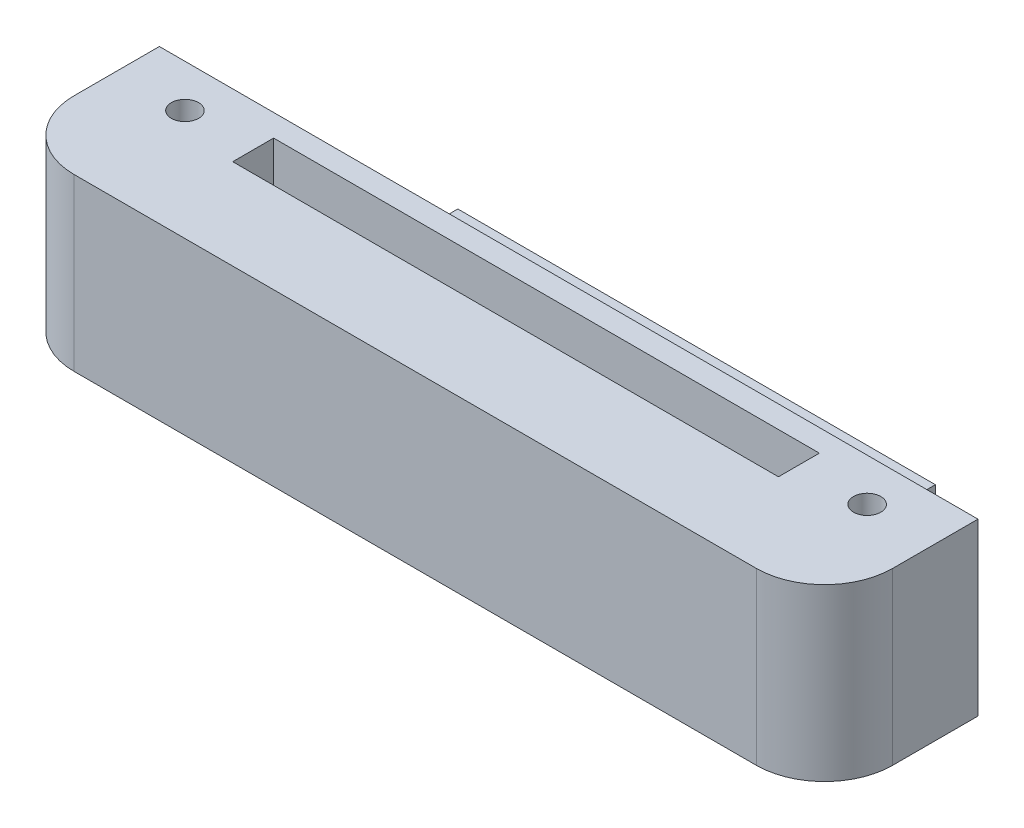
from build123d import *

# Parameters (mm, degrees)
SKETCH1_W             = 120
SKETCH1_H             = 31.25
BOSS_EXTRUDE1_DEPTH   = 25
SKETCH2_W             = 18.75
SKETCH2_H             = 17.5
CUT_EXTRUDE1_DEPTH    = 124.568364175
F_4_0MM_DOWEL_HOLE1_D = 4
SKETCH5_W             = 120
SKETCH5_H             = 25
BOSS_EXTRUDE2_DEPTH   = 10
SKETCH6_W             = 80
SKETCH6_H             = 6
CUT_EXTRUDE2_DEPTH    = 17.5
FILLET1_R             = 10
SKETCH7_W             = 25
SKETCH7_H             = 18.75
CUT_EXTRUDE3_DEPTH    = 25


with BuildPart() as part:
    # Sketch1 → Boss-Extrude1 (new body)
    with BuildSketch(Plane(origin=(0, 0, 0), x_dir=(1, 0, 0), z_dir=(0, 1, 0))):
        Rectangle(SKETCH1_W, SKETCH1_H)
    extrude(amount=BOSS_EXTRUDE1_DEPTH)

    # Sketch2 → Cut-Extrude1 (cut, through all)
    with BuildSketch(Plane(origin=(60, 0, 0), x_dir=(0, 0, -1), z_dir=(1, 0, 0))):
        with Locations((6.25, 16.25)):
            Rectangle(SKETCH2_W, SKETCH2_H)
    extrude(amount=-CUT_EXTRUDE1_DEPTH, mode=Mode.SUBTRACT)

    # Ø4.0mm Dowel Hole1 (through all)
    with Locations(Plane(origin=(0, 25, 0), x_dir=(1, 0, 0), z_dir=(0, 1, 0))):
        with Locations((50, -9.375), (-50, -9.375)):
            Hole(F_4_0MM_DOWEL_HOLE1_D / 2)

    # Sketch5 → Boss-Extrude2 (add)
    with BuildSketch(Plane.XY.offset(15.625)):
        with Locations((0, 12.5)):
            Rectangle(SKETCH5_W, SKETCH5_H)
    extrude(amount=BOSS_EXTRUDE2_DEPTH)

    # Sketch6 → Cut-Extrude2 (cut)
    with BuildSketch(Plane(origin=(0, 25, 0), x_dir=(1, 0, 0), z_dir=(0, 1, 0))):
        with Locations((0, -9.375)):
            Rectangle(SKETCH6_W, SKETCH6_H)
    extrude(amount=-CUT_EXTRUDE2_DEPTH, mode=Mode.SUBTRACT)

    # Fillet1
    fillet1_edges = [part.edges().sort_by_distance(p)[0] for p in [
        (-60, 12.5, 25.625),
        (60, 12.5, 25.625),
    ]]
    fillet(fillet1_edges, radius=FILLET1_R)

    # Sketch7 → Cut-Extrude3 (cut)
    with BuildSketch(Plane(origin=(0, 7.5, 0), x_dir=(1, 0, 0), z_dir=(0, 1, 0))):
        with Locations((-47.5, 6.25)):
            Rectangle(SKETCH7_W, SKETCH7_H)
        with Locations((47.5, 6.25)):
            Rectangle(SKETCH7_W, SKETCH7_H)
    extrude(amount=-CUT_EXTRUDE3_DEPTH, mode=Mode.SUBTRACT)


solid = part.part
